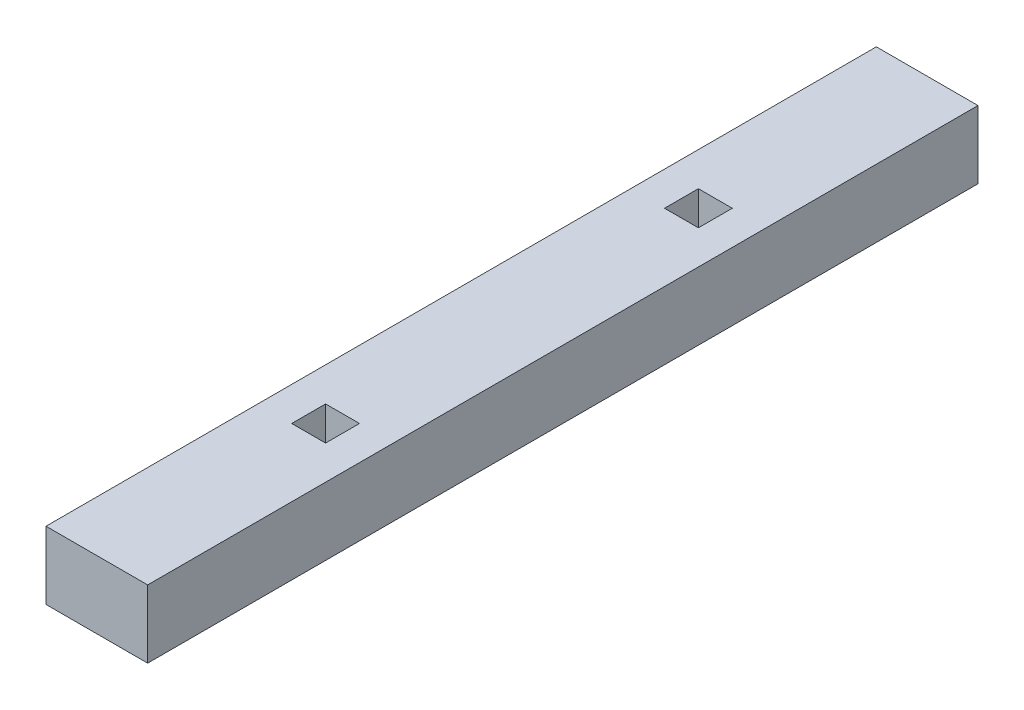
from build123d import *

# Parameters (mm, degrees)
SKETCH1_W           = 30
SKETCH1_H           = 245
SKETCH1_W_2         = 10
SKETCH1_H_2         = 10
BOSS_EXTRUDE1_DEPTH = 20


with BuildPart() as part:
    # Sketch1 → Boss-Extrude1 (new body)
    with BuildSketch(Plane(origin=(0, 0, 0), x_dir=(1, 0, 0), z_dir=(0, 1, 0))):
        with Locations((0, -5)):
            Rectangle(SKETCH1_W, SKETCH1_H)
        with Locations((0, 50)):
            Rectangle(SKETCH1_W_2, SKETCH1_H_2, mode=Mode.SUBTRACT)
        with Locations((0, -60)):
            Rectangle(SKETCH1_W_2, SKETCH1_H_2, mode=Mode.SUBTRACT)
    extrude(amount=BOSS_EXTRUDE1_DEPTH)


solid = part.part
